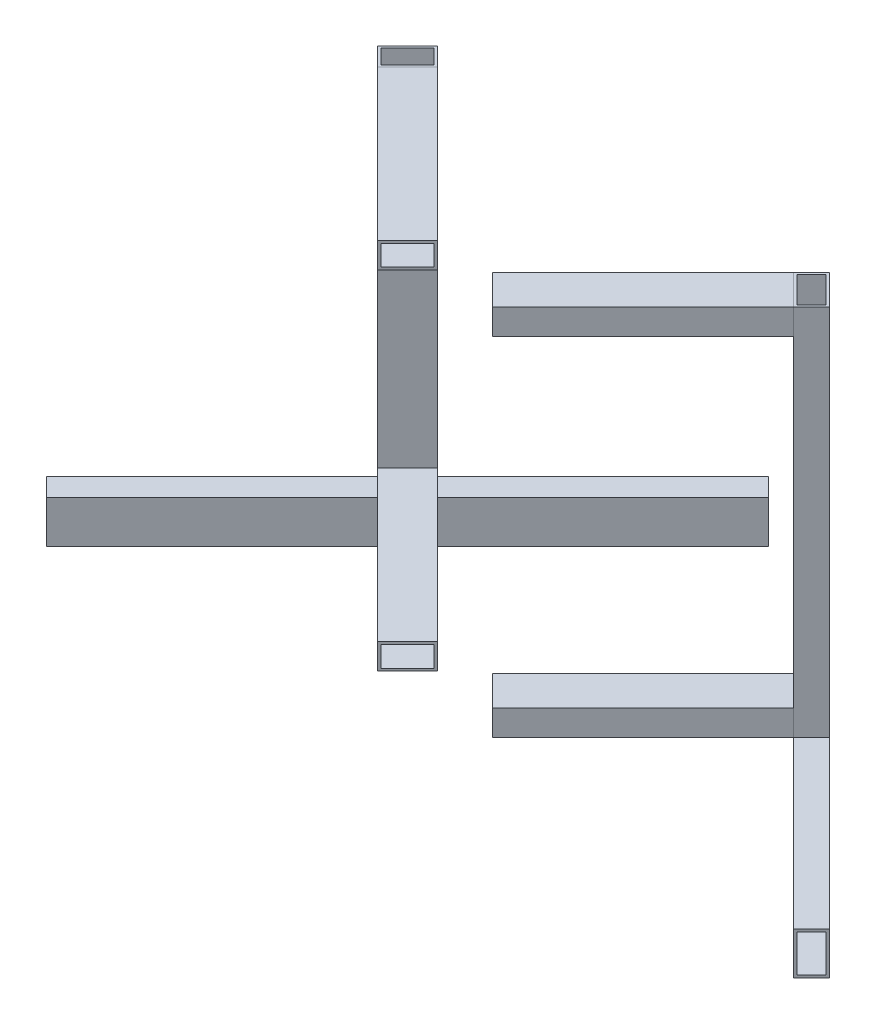
from build123d import *

# Parameters (mm, degrees)
SKETCH8_W                = 30
SKETCH8_H                = 50
SKETCH8_W_2              = 24
SKETCH8_H_2              = 44
BOSS_EXTRUDE4_DEPTH      = 250
BOSS_EXTRUDE4_2_DEPTH    = 250
BOSS_EXTRUDE5_DEPTH      = 219.04
BOSS_EXTRUDE5_DEPTH_BACK = 219.04
SKETCH10_W               = 30
SKETCH10_H               = 50
SKETCH10_W_2             = 24
SKETCH10_H_2             = 44
BOSS_EXTRUDE6_DEPTH      = 300


with BuildPart() as part:
    # Sketch8 → Boss-Extrude4 (new body)
    with BuildSketch(Plane(origin=(25, 0, -25), x_dir=(0, 1, 0), z_dir=(-0.7071067811865464, 0, 0.7071067811865488))):
        with Locations((204.04, -35.355339059)):
            Rectangle(SKETCH8_W, SKETCH8_H)
        with Locations((204.04, -35.355339059)):
            Rectangle(SKETCH8_W_2, SKETCH8_H_2, mode=Mode.SUBTRACT)
    extrude(amount=-BOSS_EXTRUDE4_DEPTH)


with BuildPart() as body_2:
    # Sketch8 → Boss-Extrude4 2 (new body)
    with BuildSketch(Plane(origin=(25, 0, -25), x_dir=(0, 1, 0), z_dir=(-0.7071067811865464, 0, 0.7071067811865488))):
        with Locations((-204.04, -35.355339059)):
            Rectangle(SKETCH8_W, SKETCH8_H)
        with Locations((-204.04, -35.355339059)):
            Rectangle(SKETCH8_W_2, SKETCH8_H_2, mode=Mode.SUBTRACT)
    extrude(amount=-BOSS_EXTRUDE4_2_DEPTH)


with BuildPart() as body_3:
    # Sketch9 → Boss-Extrude5 (new, two sides: drawn at the far end of the back side and taken through both)
    with BuildSketch(Plane(origin=(0, 0, 0), x_dir=(1, 0, 0), z_dir=(0, 1, 0)).offset(-BOSS_EXTRUDE5_DEPTH_BACK)):
        Polygon((209.099025767, 194.454364826), (244.454364826, 159.099025767), (265.667568262, 180.312229203), (230.312229203, 215.667568262), align=None)
        Polygon((213.341666454, 194.454364826), (230.312229203, 211.424927575), (261.424927575, 180.312229203), (244.454364826, 163.341666454), align=None, mode=Mode.SUBTRACT)
    extrude(amount=BOSS_EXTRUDE5_DEPTH + BOSS_EXTRUDE5_DEPTH_BACK)


with BuildPart() as body_4:
    # Sketch10 → Boss-Extrude6 (new, symmetric)
    with BuildSketch(Plane(origin=(25, 0, 25), x_dir=(0.7071067811865457, 0, -0.7071067811865493), z_dir=(0.7071067811865493, 0, 0.7071067811865457))):
        with Locations((300.355339059, -244.04)):
            Rectangle(SKETCH10_W, SKETCH10_H)
        with Locations((300.355339059, -244.04)):
            Rectangle(SKETCH10_W_2, SKETCH10_H_2, mode=Mode.SUBTRACT)
    extrude(amount=BOSS_EXTRUDE6_DEPTH, both=True)


with BuildPart() as body_5:
    # Mirror1: mirrored copy
    add(part.part.mirror(Plane(origin=(0, 0, 0), x_dir=(0, 0, 1), z_dir=(1, 0, 0))))


with BuildPart() as body_6:
    # Mirror1 2: mirrored copy
    add(body_2.part.mirror(Plane(origin=(0, 0, 0), x_dir=(0, 0, 1), z_dir=(1, 0, 0))))


with BuildPart() as body_7:
    # Mirror1 3: mirrored copy
    add(body_3.part.mirror(Plane(origin=(0, 0, 0), x_dir=(0, 0, 1), z_dir=(1, 0, 0))))


with BuildPart() as body_8:
    # Mirror1 4: mirrored copy
    add(body_4.part.mirror(Plane(origin=(0, 0, 0), x_dir=(0, 0, 1), z_dir=(1, 0, 0))))


solid = Compound([part.part, body_2.part, body_3.part, body_4.part, body_5.part, body_6.part, body_7.part, body_8.part])
